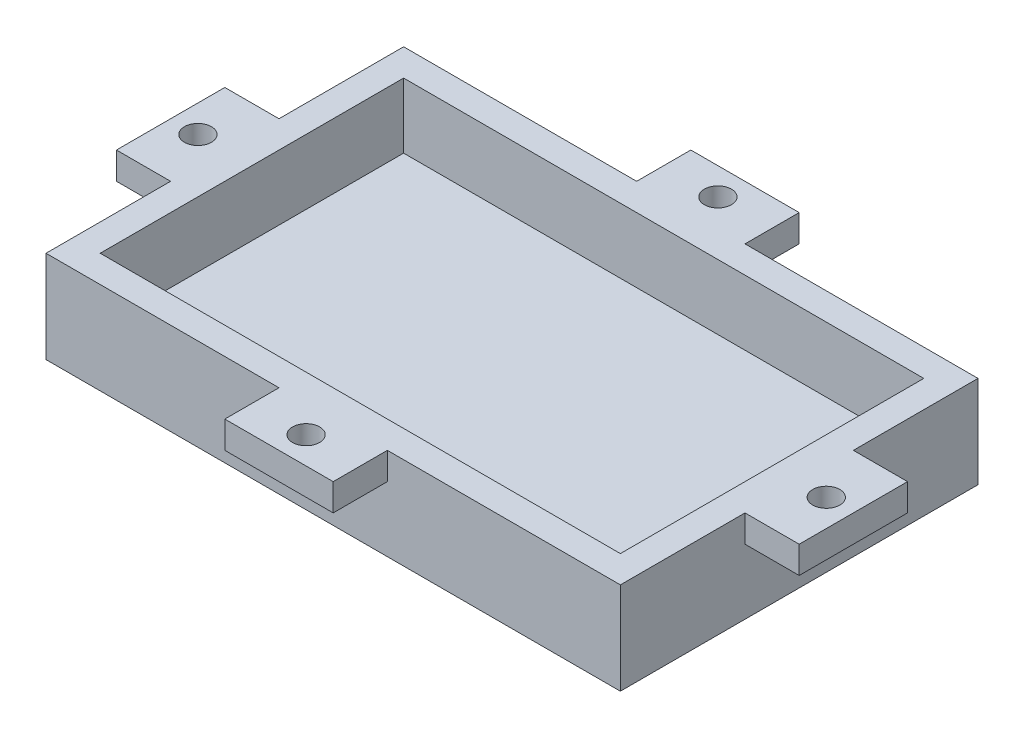
from build123d import *

# Parameters (mm, degrees)
SKETCH1_W           = 67.31
SKETCH1_H           = 41.91
BOSS_EXTRUDE5_DEPTH = 3.175
SKETCH2_W           = 67.31
SKETCH2_H           = 41.91
SKETCH2_W_2         = 60.96
SKETCH2_H_2         = 35.56
BOSS_EXTRUDE6_DEPTH = 7.62
SKETCH4_W           = 12.7
SKETCH4_H           = 6.35
SKETCH4_W_2         = 6.35
SKETCH4_H_2         = 12.7
BOSS_EXTRUDE8_DEPTH = 3.175
SKETCH6_R           = 1.5875
CUT_EXTRUDE1_DEPTH  = 50.62353348


with BuildPart() as part:
    # Sketch1 → Boss-Extrude5 (new body)
    with BuildSketch(Plane(origin=(0, 0, 0), x_dir=(1, 0, 0), z_dir=(0, 1, 0))):
        Rectangle(SKETCH1_W, SKETCH1_H)
    extrude(amount=BOSS_EXTRUDE5_DEPTH)

    # Sketch2 → Boss-Extrude6 (add)
    with BuildSketch(Plane(origin=(0, 3.175, 0), x_dir=(1, 0, 0), z_dir=(0, 1, 0))):
        Rectangle(SKETCH2_W, SKETCH2_H)
        Rectangle(SKETCH2_W_2, SKETCH2_H_2, mode=Mode.SUBTRACT)
    extrude(amount=BOSS_EXTRUDE6_DEPTH)

    # Sketch4 → Boss-Extrude8 (add)
    with BuildSketch(Plane(origin=(0, 10.795, 0), x_dir=(1, 0, 0), z_dir=(0, 1, 0))):
        with Locations((0, -24.13)):
            Rectangle(SKETCH4_W, SKETCH4_H)
        with Locations((0, 24.13)):
            Rectangle(SKETCH4_W, SKETCH4_H)
        with Locations((36.83, 0)):
            Rectangle(SKETCH4_W_2, SKETCH4_H_2)
        with Locations((-36.83, 0)):
            Rectangle(SKETCH4_W_2, SKETCH4_H_2)
    extrude(amount=-BOSS_EXTRUDE8_DEPTH)

    # Sketch6 → Cut-Extrude1 (cut, through all)
    with BuildSketch(Plane(origin=(0, 10.795, 0), x_dir=(1, 0, 0), z_dir=(0, 1, 0))):
        with BuildLine():
            ThreePointArc((0, 25.7175), (-1.5875, 24.13), (0, 22.5425))
            Line((0, 22.5425), (0, 25.7175))
        make_face()
        with BuildLine():
            Line((0, 25.7175), (0, 22.5425))
            ThreePointArc((0, 22.5425), (1.122532015, 23.007467985), (1.5875, 24.13))
            ThreePointArc((1.5875, 24.13), (1.122532015, 25.252532015), (0, 25.7175))
        make_face()
        with Locations(Location((-36.806414665, 0, 0), (0, 0, 270))):
            Circle(SKETCH6_R)
        with Locations(Location((36.83, 0, 0), (0, 0, 270))):
            Circle(SKETCH6_R)
        with Locations(Location((0, -24.13, 0), (0, 0, 270))):
            Circle(SKETCH6_R)
    extrude(amount=-CUT_EXTRUDE1_DEPTH, mode=Mode.SUBTRACT)


solid = part.part
